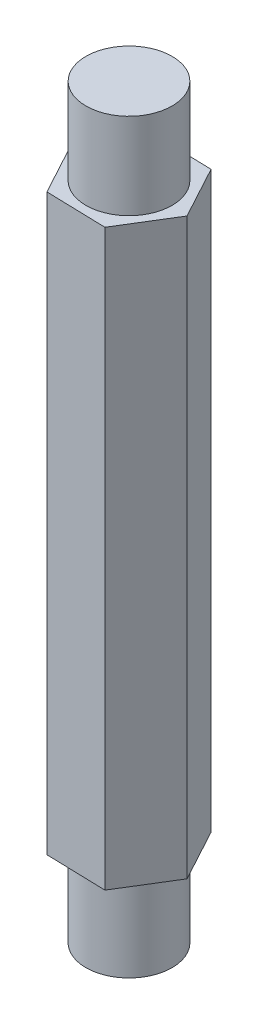
from build123d import *

# Parameters (mm, degrees)
SKETCH1_R           = 1.5
BOSS_EXTRUDE1_DEPTH = 3
BOSS_EXTRUDE2_DEPTH = 20
SKETCH3_R           = 1.5
BOSS_EXTRUDE3_DEPTH = 3


with BuildPart() as part:
    # Sketch1 → Boss-Extrude1 (new body)
    with BuildSketch(Plane(origin=(0, 0, 0), x_dir=(1, 0, 0), z_dir=(0, 1, 0))):
        with Locations(Location((0, 0, 0), (0, 0, 270))):
            Circle(SKETCH1_R)
    extrude(amount=BOSS_EXTRUDE1_DEPTH)

    # Sketch2 → Boss-Extrude2 (add)
    with BuildSketch(Plane(origin=(0, 3, 0), x_dir=(1, 0, 0), z_dir=(0, 1, 0))):
        Polygon((-0.98915483, 1.827996915), (-2.077669182, 0.057365247), (-1.088514352, -1.770631668), (0.98915483, -1.827996915), (2.077669182, -0.057365247), (1.088514352, 1.770631668), align=None)
    extrude(amount=BOSS_EXTRUDE2_DEPTH)

    # Sketch3 → Boss-Extrude3 (add)
    with BuildSketch(Plane(origin=(0, 23, 0), x_dir=(1, 0, 0), z_dir=(0, 1, 0))):
        with Locations(Location((0, 0, 0), (0, 0, 270))):
            Circle(SKETCH3_R)
    extrude(amount=BOSS_EXTRUDE3_DEPTH)


solid = part.part
